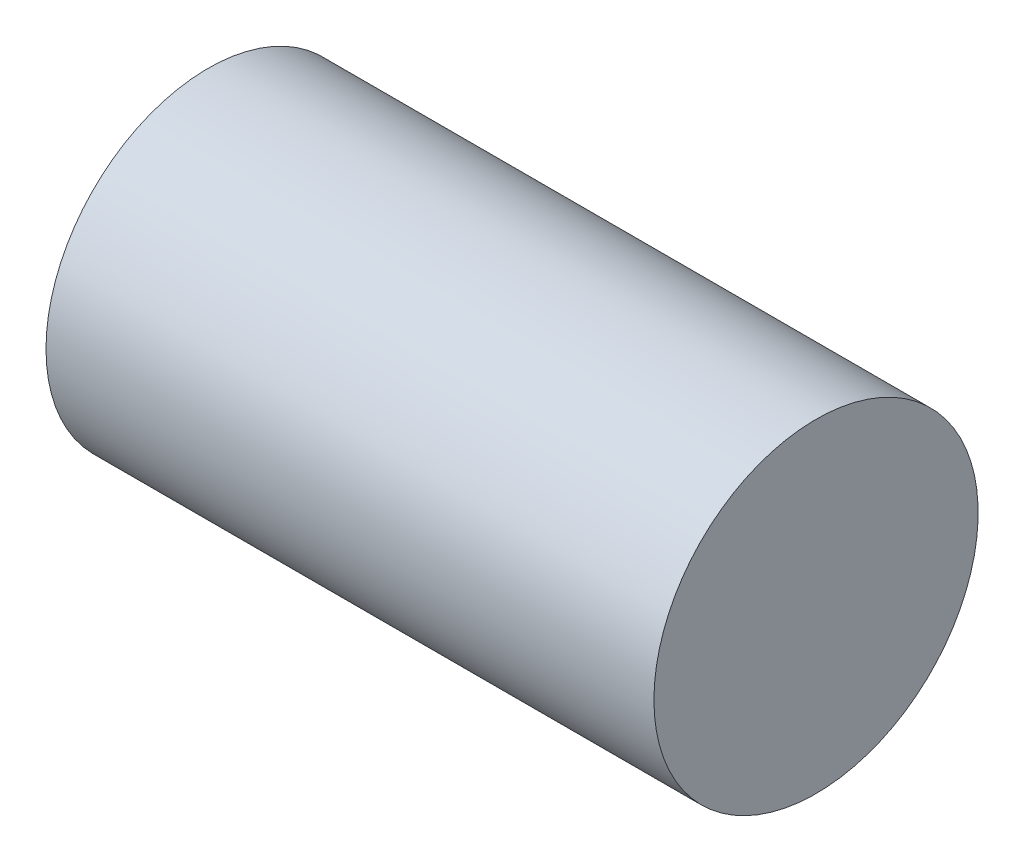
from build123d import *

# Parameters (mm, degrees)
SKETCH1_R           = 8
BOSS_EXTRUDE1_DEPTH = 30


with BuildPart() as part:
    # Sketch1 → Boss-Extrude1 (new body)
    with BuildSketch(Plane.ZY.offset(162)):
        Circle(SKETCH1_R)
    extrude(amount=BOSS_EXTRUDE1_DEPTH)


solid = part.part
